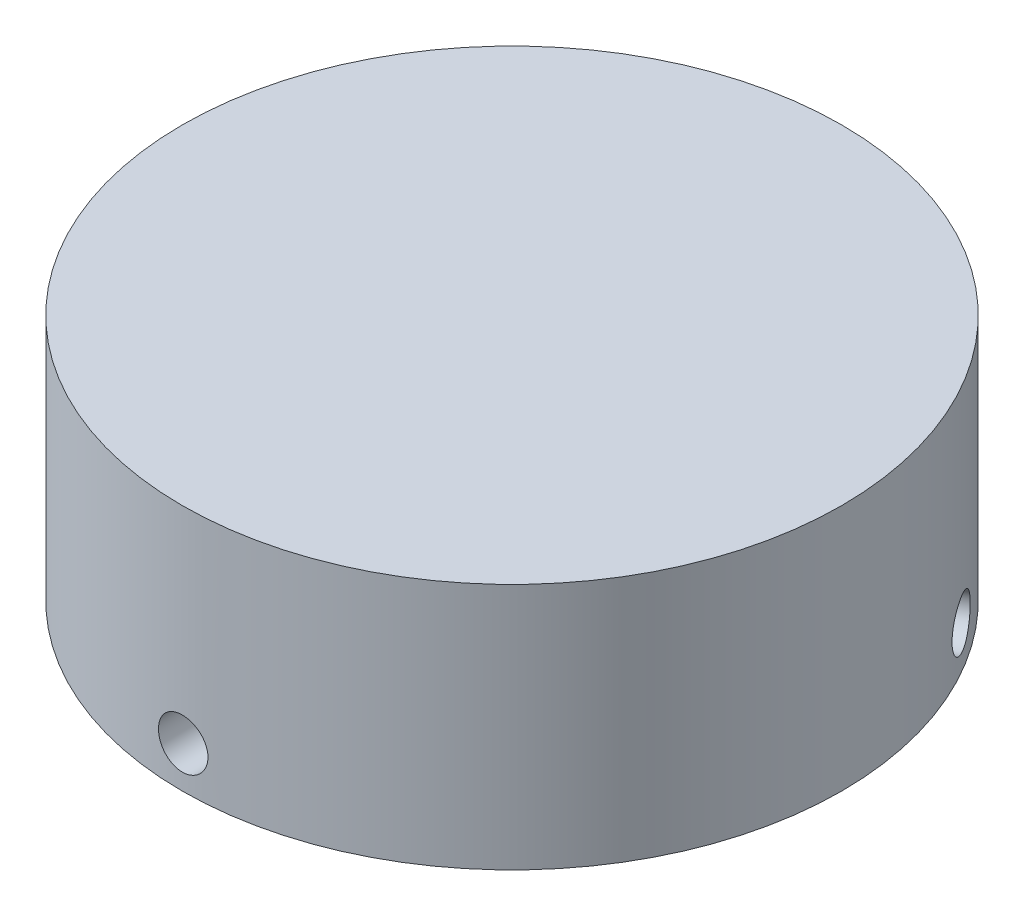
from build123d import *

# Parameters (mm, degrees)
CUT_EXTRUDE1_REACH      = 96.34
CUT_EXTRUDE1_END_RADIUS = 35
SKETCH2_R               = 3
CIRPATTERN1_COUNT       = 3


with BuildPart() as part:
    # Sketch1 → Revolve1 (revolve)
    with BuildSketch(Plane.XY, mode=Mode.PRIVATE) as revolve1_sk:
        Polygon((-40, 30), (0, 30), (0, 25), (-35, 25), (-35, 0), (-40, 0), align=None)
    revolve(revolve1_sk.sketch.rotate(Axis((0, -63.953488372, 0), (0, 1, 0)), 270), axis=Axis((0, -63.953488372, 0), (0, 1, 0)))

    # Cut-Extrude1: up to this cylinder (the profile starts outside it)
    cut_extrude1_end = Plane(origin=(0, 5, 0), z_dir=(0, -1, 0)) * Cylinder(CUT_EXTRUDE1_END_RADIUS, 263.68, mode=Mode.PRIVATE)
    # Sketch2 → Cut-Extrude1 (cut, up to the surface)
    with BuildSketch(Plane.XY.offset(40), mode=Mode.PRIVATE) as cut_extrude1_sk1:
        with Locations((0, 5)):
            Circle(SKETCH2_R)
    cut_extrude1_tool1 = extrude(cut_extrude1_sk1.sketch, amount=-CUT_EXTRUDE1_REACH, mode=Mode.PRIVATE) - cut_extrude1_end
    cut_extrude1 = cut_extrude1_tool1.solids().sort_by_distance((0, 5, 40))[0]
    add(cut_extrude1, mode=Mode.SUBTRACT)

    # CirPattern1: Cut-Extrude1 ×3 about axis
    cirpattern1_axis = Axis((0, -63.953488372, 0), (0, 1, 0))
    for i in range(1, CIRPATTERN1_COUNT):
        add(cut_extrude1.rotate(cirpattern1_axis, i * 360 / CIRPATTERN1_COUNT), mode=Mode.SUBTRACT)


solid = part.part
